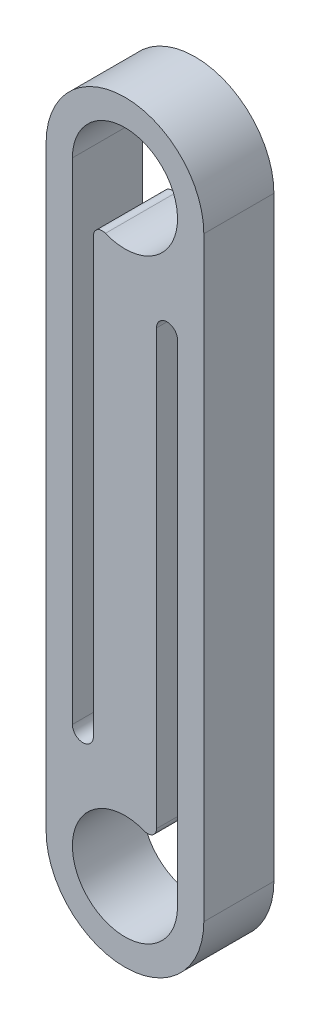
from build123d import *

# Parameters (mm, degrees)
EXTRUDE_1_DEPTH = 4


with BuildPart() as part:
    # 草图1 → 凸台-拉伸1 (new body)
    with BuildSketch(Plane.XY):
        with BuildLine():
            Line((-4.5, 34), (-4.5, 0))
            ThreePointArc((-4.5, 0), (0, -4.5), (4.5, 0))
            Line((4.5, 0), (4.5, 34))
            ThreePointArc((4.5, 34), (0, 38.5), (-4.5, 34))
        make_face()
        with BuildLine():
            Line((-3, 34), (-3, 6))
            ThreePointArc((-3, 6), (-2.4, 5.4), (-1.8, 6))
            Line((-1.8, 6), (-1.8, 30.750384638))
            ThreePointArc((-1.8, 30.750384638), (-1.580305955, 31.164423974), (-1.114285714, 31.214615404))
            ThreePointArc((-1.114285714, 31.214615404), (2.484236014, 35.681835732), (-3, 34))
        make_face(mode=Mode.SUBTRACT)
        with BuildLine():
            Line((3, 0), (3, 28))
            ThreePointArc((3, 28), (2.4, 28.6), (1.8, 28))
            Line((1.8, 28), (1.8, 3.249615362))
            ThreePointArc((1.8, 3.249615362), (1.580305955, 2.835576026), (1.114285714, 2.785384596))
            ThreePointArc((1.114285714, 2.785384596), (-2.484236014, -1.681835732), (3, 0))
        make_face(mode=Mode.SUBTRACT)
    extrude(amount=EXTRUDE_1_DEPTH)


solid = part.part
